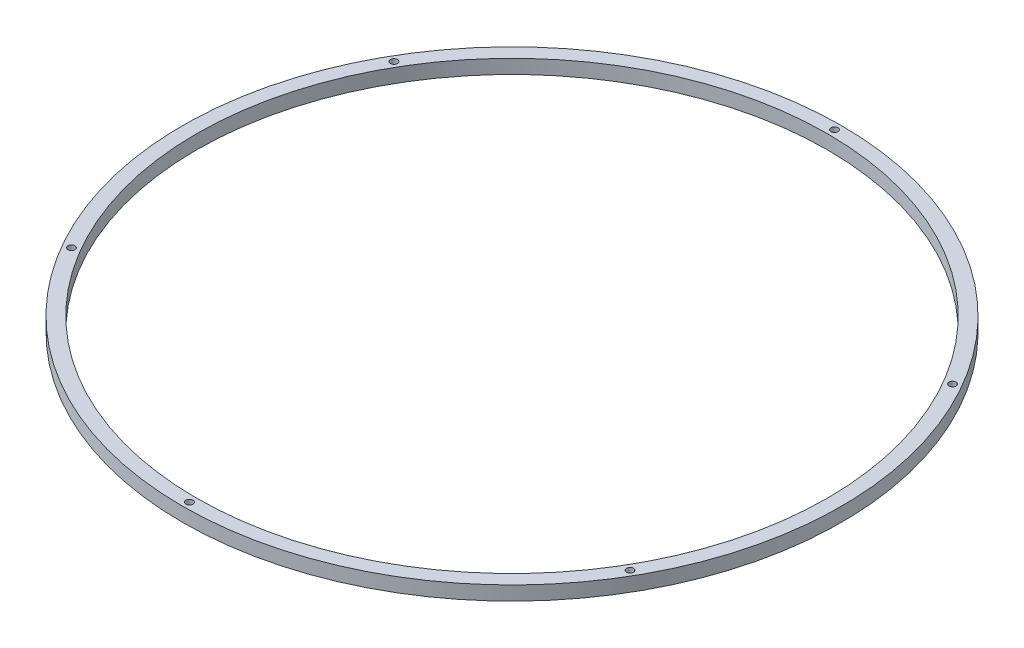
from build123d import *

# Parameters (mm, degrees)
SKETCH1_R           = 235
SKETCH1_R_2         = 225
BOSS_EXTRUDE1_DEPTH = 10
SKETCH3_R           = 2.5
CUT_EXTRUDE1_DEPTH  = 10
CIRPATTERN1_COUNT   = 6


with BuildPart() as part:
    # Sketch1 → Boss-Extrude1 (new body)
    with BuildSketch(Plane(origin=(0, 0, 0), x_dir=(1, 0, 0), z_dir=(0, 1, 0))):
        with Locations(Location((0, 0, 0), (0, 0, 270))):
            Circle(SKETCH1_R)
        with Locations(Location((0, 0, 0), (0, 0, 270))):
            Circle(SKETCH1_R_2, mode=Mode.SUBTRACT)
    extrude(amount=BOSS_EXTRUDE1_DEPTH)

    # Sketch3 → Cut-Extrude1 (cut)
    with BuildSketch(Plane(origin=(0, 10, 0), x_dir=(1, 0, 0), z_dir=(0, 1, 0))):
        with Locations(Location((0, 230, 0), (0, 0, 270))):
            Circle(SKETCH3_R)
    cut_extrude1 = extrude(amount=-CUT_EXTRUDE1_DEPTH, mode=Mode.SUBTRACT)

    # CirPattern1: Cut-Extrude1 ×6 about axis
    cirpattern1_axis = Axis((0, 0, 0), (0, 1, 0))
    for i in range(1, CIRPATTERN1_COUNT):
        add(cut_extrude1.rotate(cirpattern1_axis, i * 360 / CIRPATTERN1_COUNT), mode=Mode.SUBTRACT)


solid = part.part
